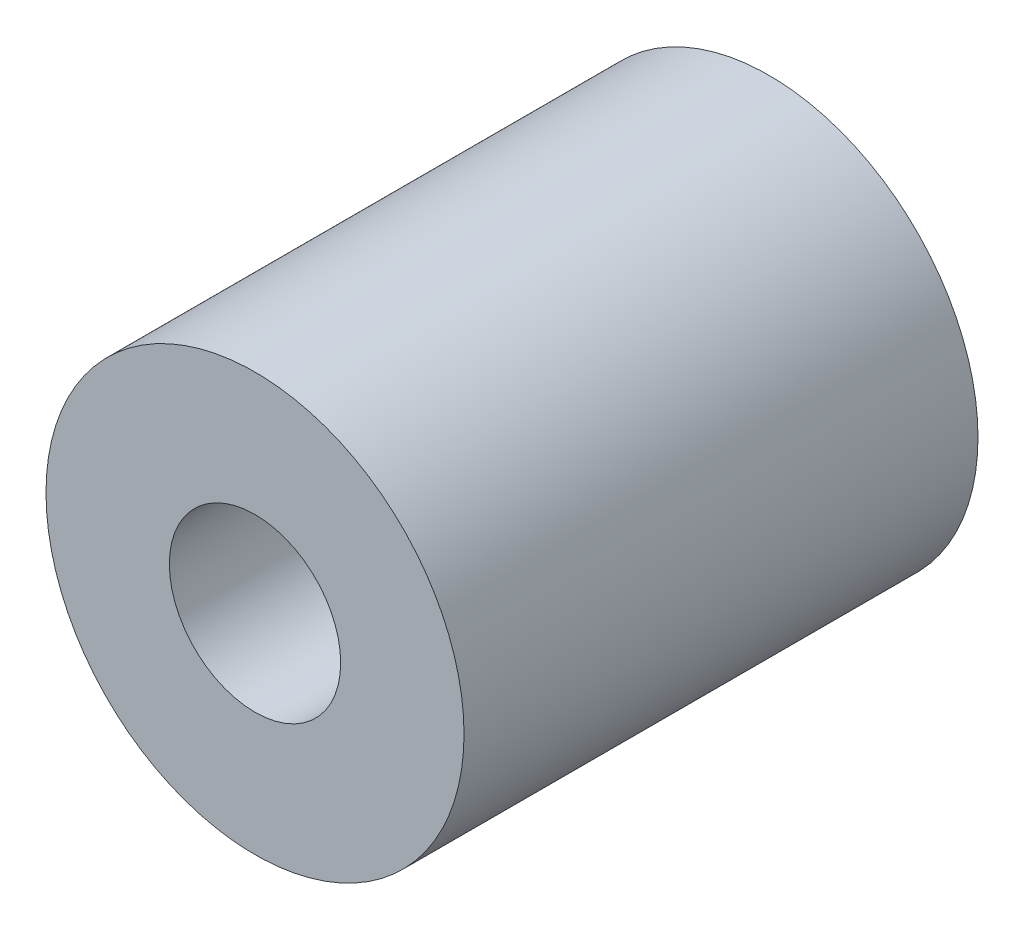
from build123d import *

# Parameters (mm, degrees)
SKETCH1_R           = 30.988
BOSS_EXTRUDE1_DEPTH = 38.1
SKETCH2_R           = 12.7
CUT_EXTRUDE1_DEPTH  = 25.4


with BuildPart() as part:
    # Sketch1 → Boss-Extrude1 (new, symmetric)
    with BuildSketch(Plane.XY):
        with Locations(Location((0, 0, 0), (0, 0, 180))):
            Circle(SKETCH1_R)
    extrude(amount=BOSS_EXTRUDE1_DEPTH, both=True)

    # Sketch2 → Cut-Extrude1 (cut)
    with BuildSketch(Plane.XY.offset(38.1)):
        Circle(SKETCH2_R)
    extrude(amount=-CUT_EXTRUDE1_DEPTH, mode=Mode.SUBTRACT)


solid = part.part
